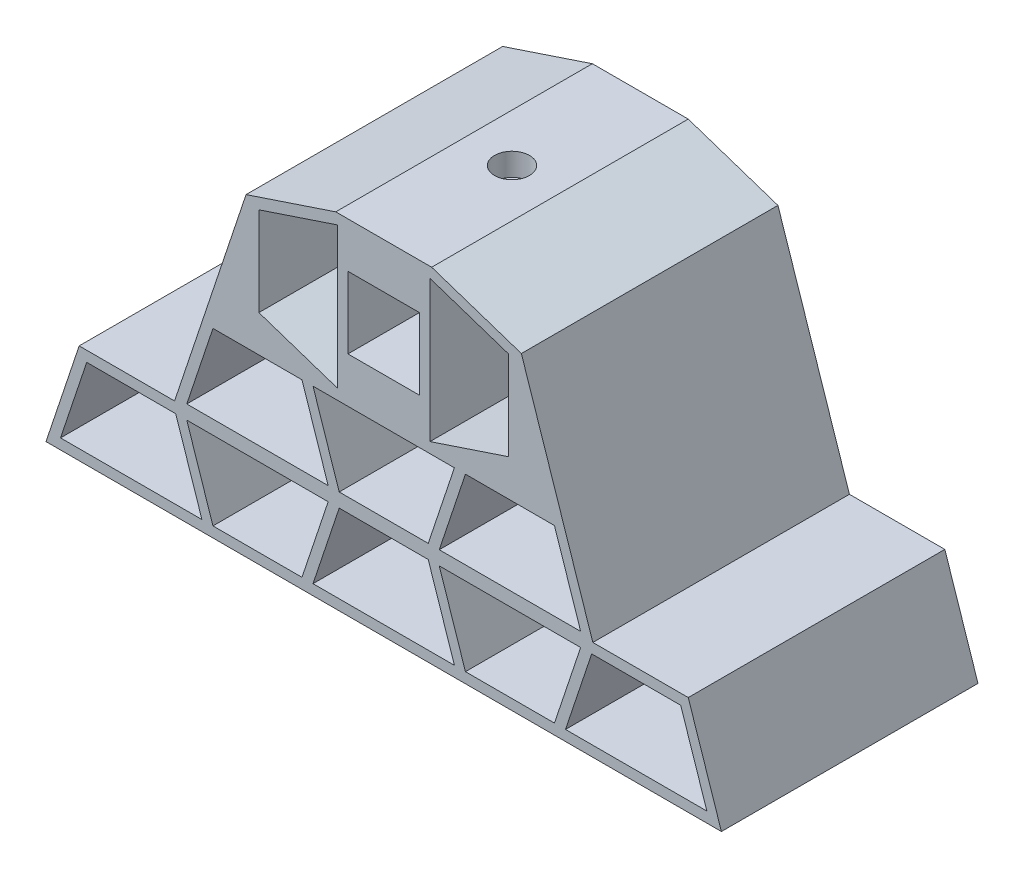
from build123d import *

# Parameters (mm, degrees)
SKETCH1_W           = 20.5
SKETCH1_H           = 20.5
BOSS_EXTRUDE1_DEPTH = 73.5
SKETCH2_R           = 2.75
CUT_EXTRUDE1_DEPTH  = 33.5
SKETCH3_R           = 5
CUT_EXTRUDE2_DEPTH  = 6.5


with BuildPart() as part:
    # Sketch1 → Boss-Extrude1 (new body)
    with BuildSketch(Plane.XY):
        Polygon((-87.236832981, -46.75), (-59.907888654, -46.75), (-39.429270613, 14.685854123), (-13.736832981, 23.25), (13.736832981, 23.25), (39.429270613, 14.685854123), (59.907888654, -46.75), (87.236832981, -46.75), (96.736832981, -75.25), (-96.736832981, -75.25), align=None)
        Polygon((-13.25, 20.25), (-13.25, -20.25), (-35.75, -12.75), (-35.75, 12.75), align=None, mode=Mode.SUBTRACT)
        Rectangle(SKETCH1_W, SKETCH1_H, mode=Mode.SUBTRACT)
        Polygon((13.25, -20.25), (35.75, -12.75), (35.75, 12.75), (13.25, 20.25), align=None, mode=Mode.SUBTRACT)
        Polygon((-12.75, -49.75), (12.75, -49.75), (20.25, -72.25), (-20.25, -72.25), align=None, mode=Mode.SUBTRACT)
        Polygon((15.91227766, -49.75), (23.41227766, -72.25), (48.91227766, -72.25), (56.41227766, -49.75), align=None, mode=Mode.SUBTRACT)
        Polygon((-48.91227766, -72.25), (-56.41227766, -49.75), (-15.91227766, -49.75), (-23.41227766, -72.25), align=None, mode=Mode.SUBTRACT)
        Polygon((59.57455532, -49.75), (52.07455532, -72.25), (92.57455532, -72.25), (85.07455532, -49.75), align=None, mode=Mode.SUBTRACT)
        Polygon((-92.57455532, -72.25), (-85.07455532, -49.75), (-59.57455532, -49.75), (-52.07455532, -72.25), align=None, mode=Mode.SUBTRACT)
        Polygon((48.91227766, -23.25), (56.41227766, -45.75), (15.91227766, -45.75), (23.41227766, -23.25), align=None, mode=Mode.SUBTRACT)
        Polygon((20.25, -23.25), (-20.25, -23.25), (-12.75, -45.75), (12.75, -45.75), align=None, mode=Mode.SUBTRACT)
        Polygon((-23.41227766, -23.25), (-48.91227766, -23.25), (-56.41227766, -45.75), (-15.91227766, -45.75), align=None, mode=Mode.SUBTRACT)
    extrude(amount=BOSS_EXTRUDE1_DEPTH)

    # Sketch2 → Cut-Extrude1 (cut)
    with BuildSketch(Plane(origin=(0, 23.25, 0), x_dir=(1, 0, 0), z_dir=(0, 1, 0))):
        with Locations(Location((0, -36.75, 0), (0, 0, 270))):
            Circle(SKETCH2_R)
    extrude(amount=-CUT_EXTRUDE1_DEPTH, mode=Mode.SUBTRACT)

    # Sketch3 → Cut-Extrude2 (cut)
    with BuildSketch(Plane(origin=(0, 23.25, 0), x_dir=(1, 0, 0), z_dir=(0, 1, 0))):
        with Locations(Location((0, -36.75, 0), (0, 0, 270))):
            Circle(SKETCH3_R)
    extrude(amount=-CUT_EXTRUDE2_DEPTH, mode=Mode.SUBTRACT)


solid = part.part
